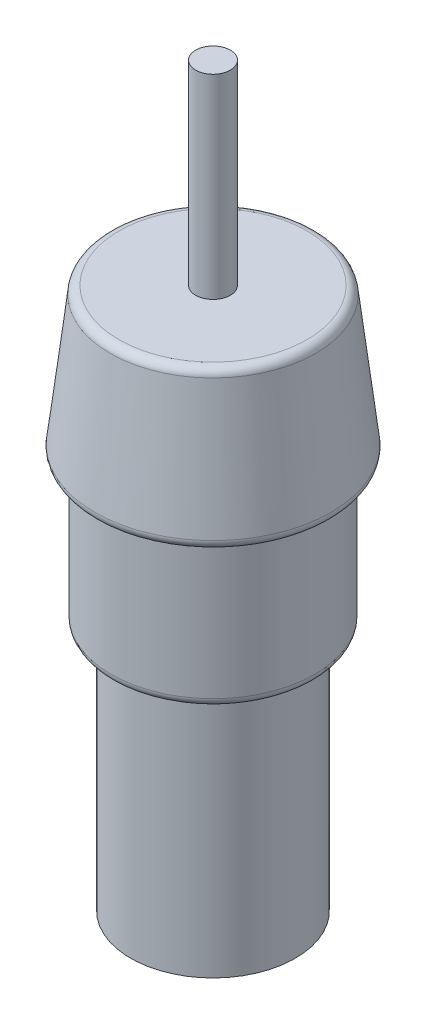
from build123d import *

# Parameters (mm, degrees)
SKETCH1_R           = 19
BOSS_EXTRUDE1_DEPTH = 57
SKETCH2_R           = 23.5
BOSS_EXTRUDE2_DEPTH = 34
SKETCH3_R           = 27.5
SKETCH4_R           = 23.5
SKETCH5_R           = 4
BOSS_EXTRUDE3_DEPTH = 45
FILLET1_R           = 2


with BuildPart() as part:
    # Sketch1 → Boss-Extrude1 (new body)
    with BuildSketch(Plane(origin=(0, 0, 0), x_dir=(1, 0, 0), z_dir=(0, 1, 0))):
        with Locations(Location((-72.248941829, 15.932254861, 0), (0, 0, 90))):
            Circle(SKETCH1_R)
    extrude(amount=BOSS_EXTRUDE1_DEPTH)

    # Sketch2 → Boss-Extrude2 (add)
    with BuildSketch(Plane(origin=(0, 57, 0), x_dir=(1, 0, 0), z_dir=(0, 1, 0))):
        with Locations(Location((-72.248941829, 15.932254861, 0), (0, 0, 270))):
            Circle(SKETCH2_R)
    extrude(amount=BOSS_EXTRUDE2_DEPTH)

    # Sketch3 → Loft1 section 0
    with BuildSketch(Plane(origin=(0, 91, 0), x_dir=(1, 0, 0), z_dir=(0, 1, 0))):
        with Locations((-72.248941829, 15.932254861)):
            Circle(SKETCH3_R)
    # Sketch4 → Loft1 section 1
    with BuildSketch(Plane(origin=(0, 125, 0), x_dir=(1, 0, 0), z_dir=(0, 1, 0))):
        with Locations((-72.248941829, 15.932254861)):
            Circle(SKETCH4_R)
    loft()

    # Sketch5 → Boss-Extrude3 (add)
    with BuildSketch(Plane(origin=(0, 125, 0), x_dir=(1, 0, 0), z_dir=(0, 1, 0))):
        with Locations(Location((-72.248941829, 15.932254861, 0), (0, 0, 90))):
            Circle(SKETCH5_R)
    extrude(amount=BOSS_EXTRUDE3_DEPTH)

    # Fillet1
    fillet1_edges = [part.edges().sort_by_distance(p)[0] for p in [
        (-95.748941829, 125, -15.932254861),
        (-99.748941829, 91, -15.932254861),
        (-72.248941829, 57, -39.432254861),
    ]]
    fillet(fillet1_edges, radius=FILLET1_R)


solid = part.part
